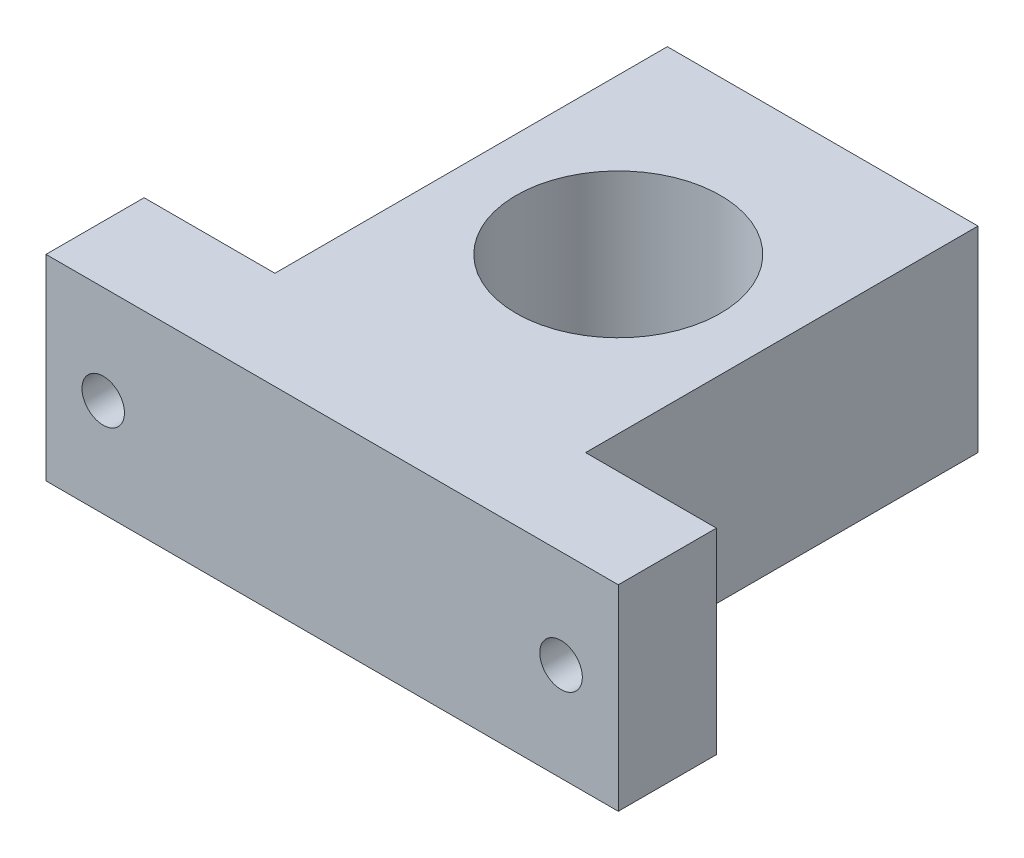
from build123d import *

# Parameters (mm, degrees)
SKETCH_1_R          = 12.5
EXTRUDE_1_DEPTH     = 24
SKETCH_2_R          = 2.6
CUT_EXTRUDE_1_DEPTH = 24


with BuildPart() as part:
    # 草图1 → 凸台-拉伸1 (new body)
    with BuildSketch(Plane(origin=(0, 0, 0), x_dir=(1, 0, 0), z_dir=(0, 1, 0))):
        Polygon((35, 0), (-35, 0), (-35, 12), (-19, 12), (-19, 60), (19, 60), (19, 12), (35, 12), align=None)
        with Locations(Location((0, 35, 0), (0, 0, 270))):
            Circle(SKETCH_1_R, mode=Mode.SUBTRACT)
    extrude(amount=EXTRUDE_1_DEPTH)

    # 草图2 → 切除-拉伸1 (cut)
    with BuildSketch(Plane(origin=(0, 0, -12), x_dir=(-1, 0, 0), z_dir=(0, 0, -1))):
        with Locations((-28, 12)):
            Circle(SKETCH_2_R)
        with Locations((28, 12)):
            Circle(SKETCH_2_R)
    extrude(amount=-CUT_EXTRUDE_1_DEPTH, mode=Mode.SUBTRACT)


solid = part.part
